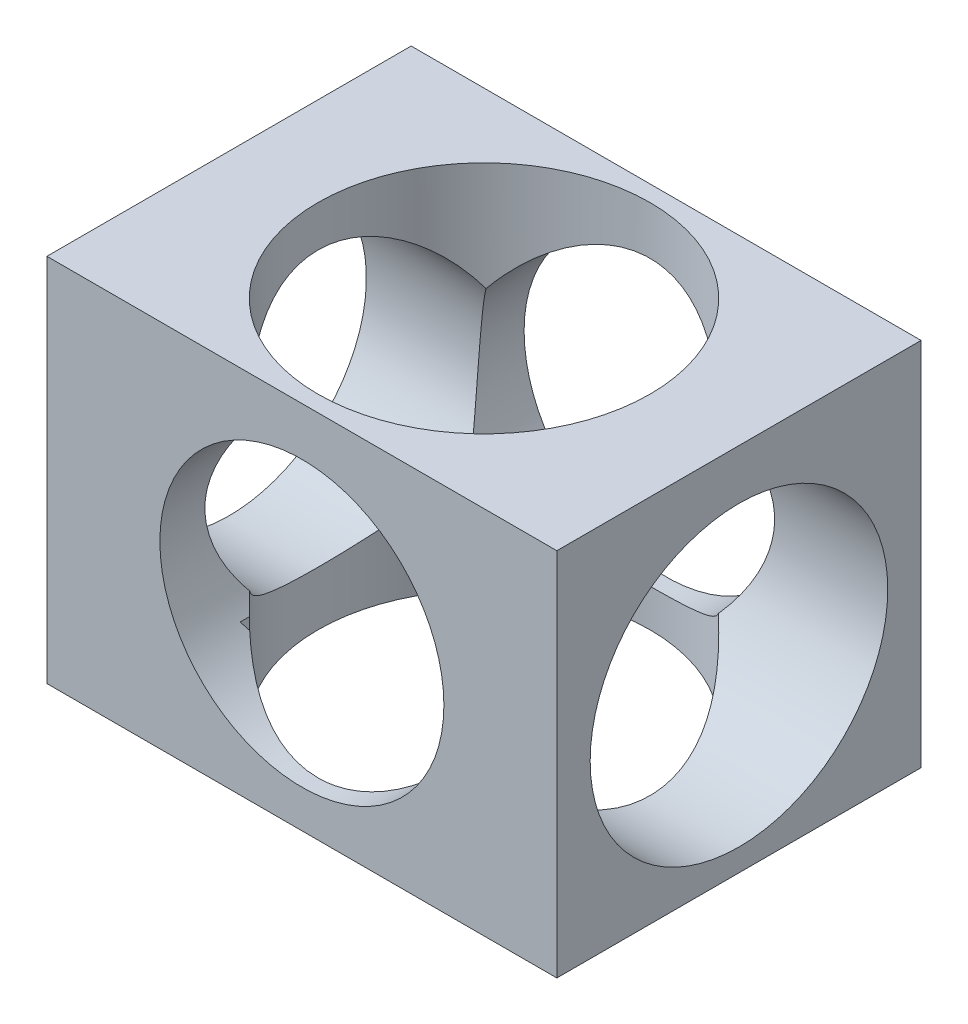
from build123d import *

# Parameters (mm, degrees)
SKETCH1_W           = 88.9
SKETCH1_H           = 63.5
BOSS_EXTRUDE1_DEPTH = 64.516
SKETCH3_R           = 23.94583075
CUT_EXTRUDE1_DEPTH  = 64.516
SKETCH5_R           = 24.756604219
CUT_EXTRUDE2_DEPTH  = 64.516
SKETCH6_R           = 25.939631921
CUT_EXTRUDE3_DEPTH  = 64.516
SKETCH7_R           = 28.940884866
CUT_EXTRUDE4_DEPTH  = 64.516


with BuildPart() as part:
    # Sketch1 → Boss-Extrude1 (new body)
    with BuildSketch(Plane(origin=(0, 0, 0), x_dir=(1, 0, 0), z_dir=(0, 1, 0))):
        Rectangle(SKETCH1_W, SKETCH1_H)
    extrude(amount=BOSS_EXTRUDE1_DEPTH)

    # Sketch3 → Cut-Extrude1 (cut)
    with BuildSketch(Plane.ZY.offset(44.45)):
        with Locations((0, 33.401592252)):
            Circle(SKETCH3_R)
    extrude(amount=-CUT_EXTRUDE1_DEPTH, mode=Mode.SUBTRACT)

    # Sketch5 → Cut-Extrude2 (cut)
    with BuildSketch(Plane.XY.offset(31.75)):
        with Locations((0, 31.339489481)):
            Circle(SKETCH5_R)
    extrude(amount=-CUT_EXTRUDE2_DEPTH, mode=Mode.SUBTRACT)

    # Sketch6 → Cut-Extrude3 (cut)
    with BuildSketch(Plane(origin=(44.45, 0, 0), x_dir=(0, 0, -1), z_dir=(1, 0, 0))):
        with Locations((0, 29.839778376)):
            Circle(SKETCH6_R)
    extrude(amount=-CUT_EXTRUDE3_DEPTH, mode=Mode.SUBTRACT)

    # Sketch7 → Cut-Extrude4 (cut)
    with BuildSketch(Plane(origin=(0, 64.516, 0), x_dir=(1, 0, 0), z_dir=(0, 1, 0))):
        with Locations(Location((0, 0, 0), (0, 0, 270))):
            Circle(SKETCH7_R)
    extrude(amount=-CUT_EXTRUDE4_DEPTH, mode=Mode.SUBTRACT)


solid = part.part
